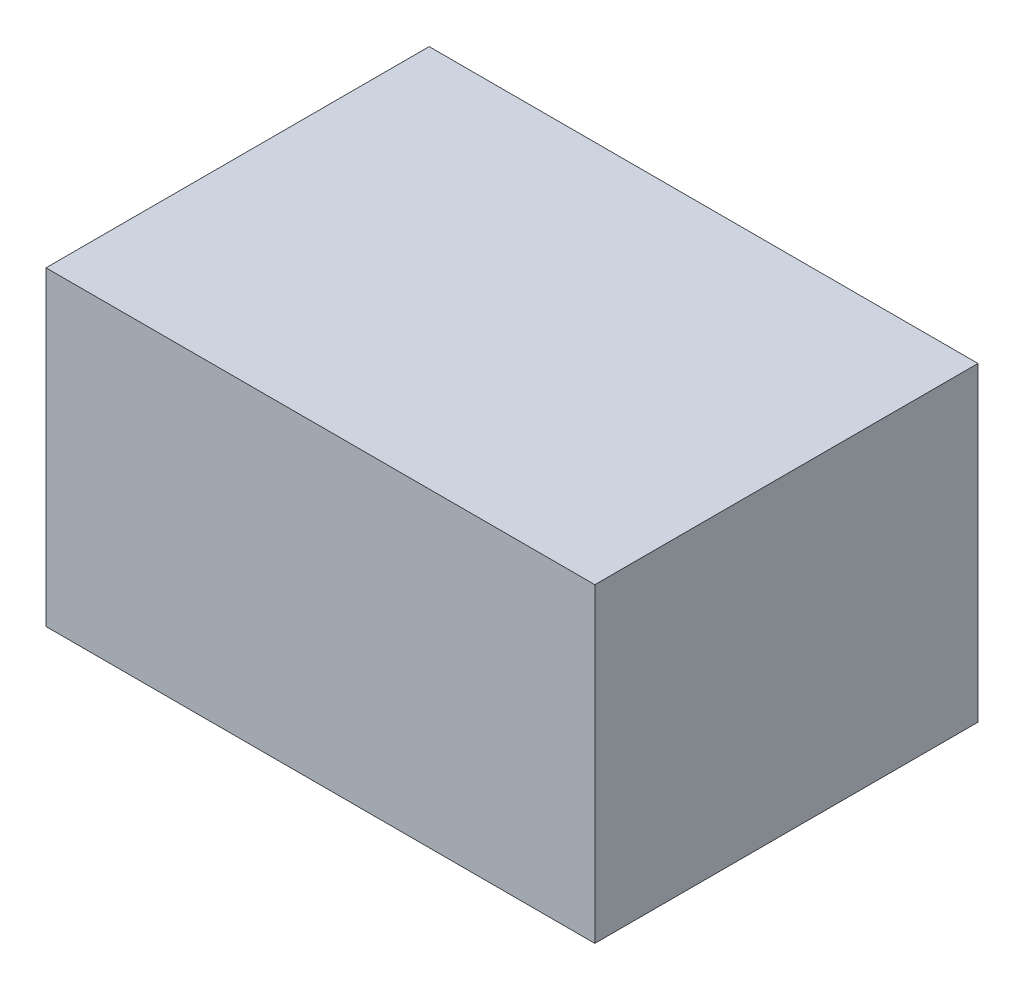
from build123d import *

# Parameters (mm, degrees)
SKETCH1_W           = 265
SKETCH1_H           = 185
BOSS_EXTRUDE1_DEPTH = 75


with BuildPart() as part:
    # Sketch1 → Boss-Extrude1 (new, symmetric)
    with BuildSketch(Plane(origin=(0, 0, 0), x_dir=(1, 0, 0), z_dir=(0, 1, 0))):
        Rectangle(SKETCH1_W, SKETCH1_H)
    extrude(amount=BOSS_EXTRUDE1_DEPTH, both=True)


solid = part.part
